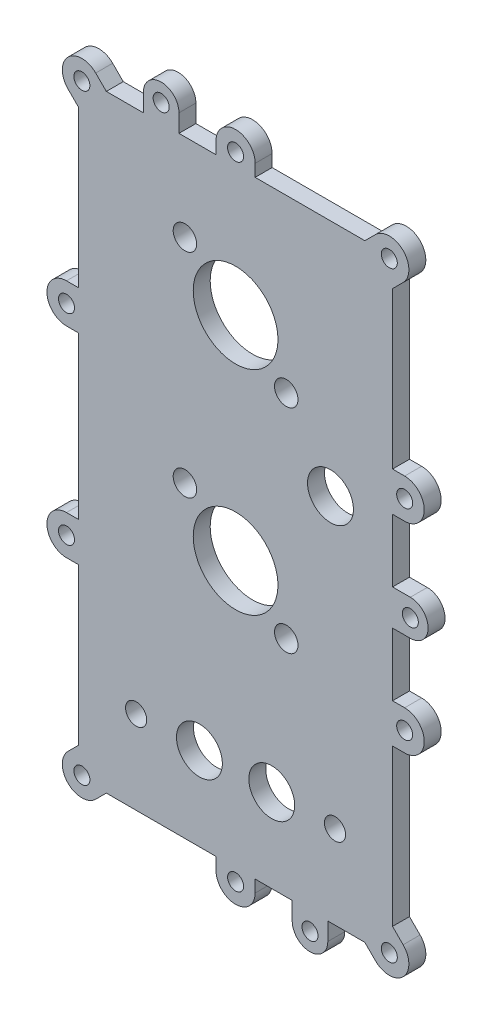
from build123d import *

# Parameters (mm, degrees)
BOSS_EXTRUDE1_DEPTH  = 4.7625
M4_CLEARANCE_HOLE1_D = 4.5
SKETCH4_R            = 3.3
SKETCH4_R_2          = 2.9765625
SKETCH4_R_3          = 6.445
SKETCH4_R_4          = 11.9
CUT_EXTRUDE1_DEPTH   = 4.7625
BOSS_EXTRUDE3_DEPTH  = 4.7625
M4_CLEARANCE_HOLE2_D = 4.5


with BuildPart() as part:
    # Sketch1 → Boss-Extrude1 (new body)
    with BuildSketch(Plane.XY):
        with BuildLine():
            Line((50.349976536, 7.779015878), (19.528151129, 7.779015878))
            Line((19.528151129, 7.779015878), (16.547693582, 10.759473425))
            ThreePointArc((16.547693582, 10.759473425), (8.769518989, 10.759473425), (8.769518989, 2.981298831))
            Line((8.769518989, 2.981298831), (11.749976536, 0.000841285))
            Line((11.749976536, 0.000841285), (11.749976536, -43.901984122))
            Line((11.749976536, -43.901984122), (8.340276536, -43.901984122))
            ThreePointArc((8.340276536, -43.901984122), (2.840276536, -49.401984122), (8.340276536, -54.901984122))
            Line((8.340276536, -54.901984122), (11.749976536, -54.901984122))
            Line((11.749976536, -54.901984122), (11.749976536, -100.289984122))
            Line((11.749976536, -100.289984122), (8.340276536, -100.289984122))
            ThreePointArc((8.340276536, -100.289984122), (2.840276536, -105.789984122), (8.340276536, -111.289984122))
            Line((8.340276536, -111.289984122), (11.749976536, -111.289984122))
            Line((11.749976536, -111.289984122), (11.749976536, -155.192809529))
            Line((11.749976536, -155.192809529), (8.769518989, -158.173267075))
            ThreePointArc((8.769518989, -158.173267075), (8.769518989, -165.951441668), (16.547693582, -165.951441668))
            Line((16.547693582, -165.951441668), (19.528151129, -162.970984122))
            Line((19.528151129, -162.970984122), (50.349976536, -162.970984122))
            Line((50.349976536, -162.970984122), (50.349976536, -166.380684122))
            ThreePointArc((50.349976536, -166.380684122), (55.849976536, -171.880684122), (61.349976536, -166.380684122))
            Line((61.349976536, -166.380684122), (61.349976536, -162.970984122))
            Line((61.349976536, -162.970984122), (92.171801943, -162.970984122))
            Line((92.171801943, -162.970984122), (95.152259489, -165.951441668))
            ThreePointArc((95.152259489, -165.951441668), (102.930434082, -165.951441668), (102.930434082, -158.173267075))
            Line((102.930434082, -158.173267075), (99.949976536, -155.192809529))
            Line((99.949976536, -155.192809529), (99.949976536, -111.289984122))
            Line((99.949976536, -111.289984122), (103.359676536, -111.289984122))
            ThreePointArc((103.359676536, -111.289984122), (108.859676536, -105.789984122), (103.359676536, -100.289984122))
            Line((103.359676536, -100.289984122), (99.949976536, -100.289984122))
            Line((99.949976536, -100.289984122), (99.949976536, -54.901984122))
            Line((99.949976536, -54.901984122), (103.359676536, -54.901984122))
            ThreePointArc((103.359676536, -54.901984122), (108.859676536, -49.401984122), (103.359676536, -43.901984122))
            Line((103.359676536, -43.901984122), (99.949976536, -43.901984122))
            Line((99.949976536, -43.901984122), (99.949976536, 0.000841285))
            Line((99.949976536, 0.000841285), (102.930434082, 2.981298831))
            ThreePointArc((102.930434082, 2.981298831), (102.930434082, 10.759473425), (95.152259489, 10.759473425))
            Line((95.152259489, 10.759473425), (92.171801943, 7.779015878))
            Line((92.171801943, 7.779015878), (61.349976536, 7.779015878))
            Line((61.349976536, 7.779015878), (61.349976536, 11.188715878))
            ThreePointArc((61.349976536, 11.188715878), (55.849976536, 16.688715878), (50.349976536, 11.188715878))
            Line((50.349976536, 11.188715878), (50.349976536, 7.779015878))
        make_face()
    extrude(amount=-BOSS_EXTRUDE1_DEPTH)

    # M4 Clearance Hole1 (through all)
    with Locations(Plane(origin=(0, 0, -4.7625), x_dir=(-1, 0, 0), z_dir=(0, 0, -1))):
        with Locations((-12.658606286, -162.062354372), (-55.849976536, -166.380684122), (-99.041346785, -162.062354372), (-103.359676536, -105.789984122), (-103.359676536, -49.401984122), (-99.041346785, 6.870386128), (-12.658606286, 6.870386128), (-8.340276536, -49.401984122), (-8.340276536, -105.789984122), (-55.849976536, 11.188715878)):
            Hole(M4_CLEARANCE_HOLE1_D / 2)

    # Sketch4 → Cut-Extrude1 (cut)
    with BuildSketch(Plane(origin=(0, 0, -4.7625), x_dir=(-1, 0, 0), z_dir=(0, 0, -1))):
        with Locations((-41.616084767, -16.665859852)):
            Circle(SKETCH4_R)
        with Locations((-70.083868304, -40.3002691)):
            Circle(SKETCH4_R)
        with Locations((-27.909976536, -139.508484122)):
            Circle(SKETCH4_R_2)
        with Locations((-41.616084767, -76.466699143)):
            Circle(SKETCH4_R)
        with Locations((-83.789976536, -139.508484122)):
            Circle(SKETCH4_R_2)
        with Locations((-70.083868304, -100.101108391)):
            Circle(SKETCH4_R)
        with Locations((-66.009976536, -139.508484122)):
            Circle(SKETCH4_R_3)
        with Locations((-82.519976536, -59.220984122)):
            Circle(SKETCH4_R_3)
        with Locations((-45.689976536, -139.508484122)):
            Circle(SKETCH4_R_3)
        with Locations((-55.849976536, -88.283903767)):
            Circle(SKETCH4_R_4)
        with Locations((-55.849976536, -28.483064476)):
            Circle(SKETCH4_R_4)
    extrude(amount=-CUT_EXTRUDE1_DEPTH, mode=Mode.SUBTRACT)

    # Sketch6 → Boss-Extrude3 (add)
    with BuildSketch(Plane.XY):
        with BuildLine():
            ThreePointArc((39.939063832, 12.779015878), (34.939063832, 17.779015878), (29.939063832, 12.779015878))
            Line((29.939063832, 12.779015878), (29.939063832, 7.779015878))
            Line((29.939063832, 7.779015878), (39.939063832, 7.779015878))
            Line((39.939063832, 7.779015878), (39.939063832, 12.779015878))
        make_face()
        with BuildLine():
            Line((81.760889239, -162.970984122), (71.760889239, -162.970984122))
            Line((71.760889239, -162.970984122), (71.760889239, -167.970984122))
            ThreePointArc((71.760889239, -167.970984122), (76.760889239, -172.970984122), (81.760889239, -167.970984122))
            Line((81.760889239, -167.970984122), (81.760889239, -162.970984122))
        make_face()
        with BuildLine():
            Line((99.949976536, -72.595984122), (99.949976536, -82.595984122))
            Line((99.949976536, -82.595984122), (104.949976536, -82.595984122))
            ThreePointArc((104.949976536, -82.595984122), (109.949976536, -77.595984122), (104.949976536, -72.595984122))
            Line((104.949976536, -72.595984122), (99.949976536, -72.595984122))
        make_face()
    extrude(amount=-BOSS_EXTRUDE3_DEPTH)

    # M4 Clearance Hole2 (through all)
    with Locations(Plane.XY):
        with Locations((34.939063832, 12.779015878), (104.949976536, -77.595984122), (76.760889239, -167.970984122)):
            Hole(M4_CLEARANCE_HOLE2_D / 2)


solid = part.part
